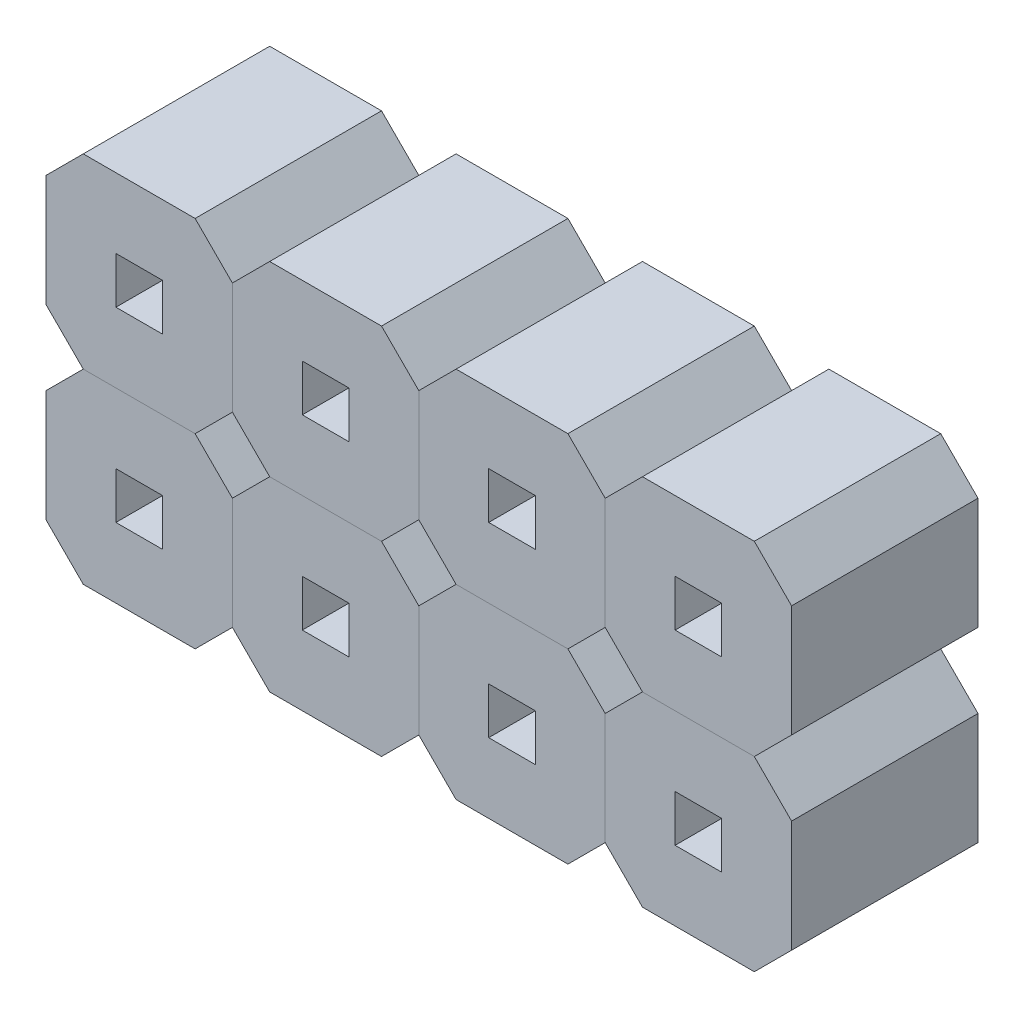
from build123d import *

# Parameters (mm, degrees)
SKETCH1_W           = 0.635
SKETCH1_H           = 0.635
BOSS_EXTRUDE1_DEPTH = 2.54
LPATTERN1_COUNT     = 4
LPATTERN1_PITCH     = 2.54
LPATTERN1_2_COUNT   = 2
LPATTERN1_2_PITCH   = 2.54


with BuildPart() as part:
    # Sketch1 → Boss-Extrude1 (new body)
    with BuildSketch(Plane.XY):
        Polygon((2.032, 2.54), (2.54, 2.032), (2.54, 0.508), (2.032, 0), (0.508, 0), (0, 0.508), (0, 2.032), (0.508, 2.54), align=None)
        with Locations((1.27, 1.27)):
            Rectangle(SKETCH1_W, SKETCH1_H, mode=Mode.SUBTRACT)
    extrude(amount=BOSS_EXTRUDE1_DEPTH)


with BuildPart() as lpattern1_1:
    # LPattern1: pattern copy
    add(part.part.moved(Location(Vector(-1, 0, 0) * (1 * LPATTERN1_PITCH))))


with BuildPart() as lpattern1_2:
    # LPattern1: pattern copy
    add(part.part.moved(Location(Vector(-1, 0, 0) * (2 * LPATTERN1_PITCH))))


with BuildPart() as lpattern1_3:
    # LPattern1: pattern copy
    add(part.part.moved(Location(Vector(-1, 0, 0) * (3 * LPATTERN1_PITCH))))


with BuildPart() as lpattern1_2_1:
    # LPattern1 2: pattern copy
    add(part.part.moved(Location(Vector(0, -1, 0) * (1 * LPATTERN1_2_PITCH))))


with BuildPart() as lpattern1_2_2:
    # LPattern1 2: pattern copy
    add(lpattern1_1.part.moved(Location(Vector(0, -1, 0) * (1 * LPATTERN1_2_PITCH))))


with BuildPart() as lpattern1_2_3:
    # LPattern1 2: pattern copy
    add(lpattern1_2.part.moved(Location(Vector(0, -1, 0) * (1 * LPATTERN1_2_PITCH))))


with BuildPart() as lpattern1_2_4:
    # LPattern1 2: pattern copy
    add(lpattern1_3.part.moved(Location(Vector(0, -1, 0) * (1 * LPATTERN1_2_PITCH))))


solid = Compound([part.part, lpattern1_1.part, lpattern1_2.part, lpattern1_3.part, lpattern1_2_1.part, lpattern1_2_2.part, lpattern1_2_3.part, lpattern1_2_4.part])
